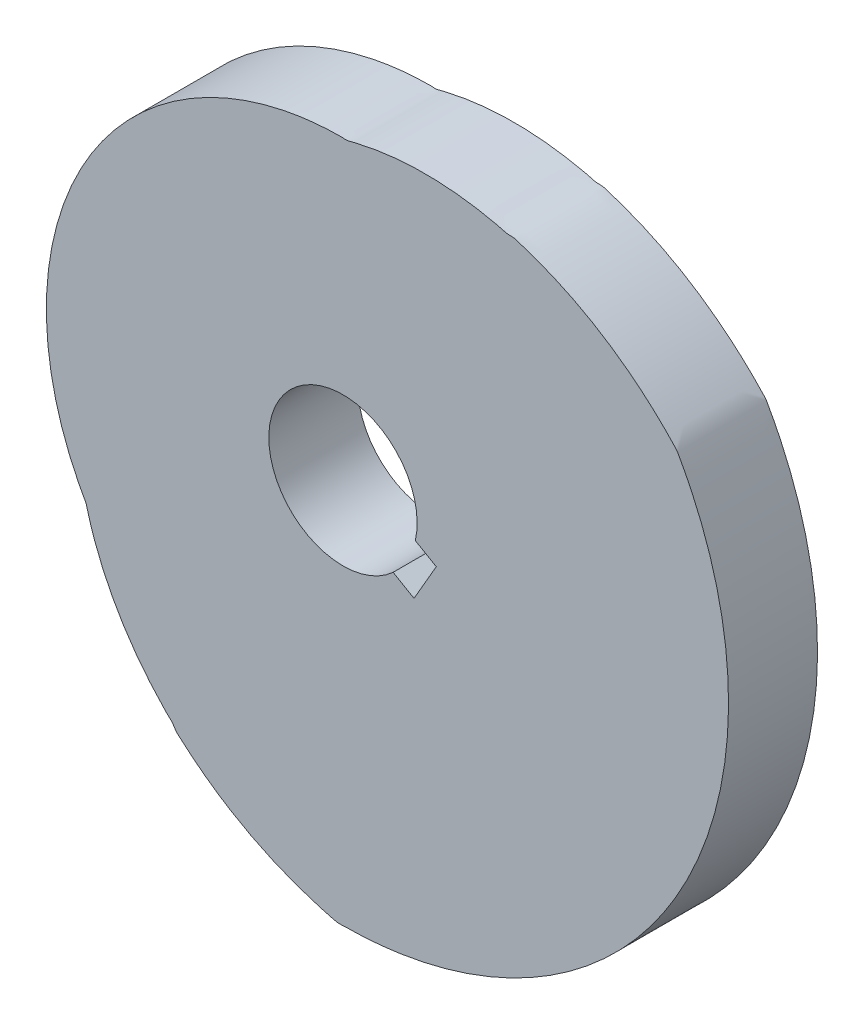
from build123d import *

# Parameters (mm, degrees)
EXTRUDE_1_DEPTH          = 12
CUT_EXTRUDE_1_DEPTH      = 12
CUT_EXTRUDE_1_DEPTH_BACK = 12


with BuildPart() as part:
    # 草图1 → 凸台-拉伸1 (new body)
    with BuildSketch(Plane.XY):
        with BuildLine():
            add(Edge.make_bspline(
                [(45.137513942, 25.818691584), (67.363308239, -13.03754157), (44.986779821, -51.807165802), (0.223448991, -51.999519907), (0.173368394, -51.99973511), (0.073206578, -52.000020819), (-0.076735083, -52.015008994), (-0.176292162, -52.026527477), (-0.226209632, -52.030572063), (-0.76984132, -52.074620074), (-1.585327729, -51.818698553), (-2.700476137, -51.534705039), (-3.585117152, -51.277157917), (-4.462156469, -51.008343252), (-5.330760731, -50.723569518), (-6.190830448, -50.424349041), (-7.04207655, -50.110546487), (-7.884266535, -49.782470849), (-8.717158972, -49.440317894), (-9.540521037, -49.084318592), (-10.354123924, -48.714699437), (-11.15774415, -48.331692882), (-11.95116328, -47.935534428), (-12.734168081, -47.526463259), (-13.506550545, -47.104721933), (-14.268107972, -46.670556345), (-15.018642937, -46.224215525), (-15.757963662, -45.76595181), (-16.485882849, -45.296019699), (-17.202222243, -44.814679573), (-17.906795909, -44.322183346), (-18.599472479, -43.818827182), (-19.279944392, -43.304755372), (-19.948584178, -42.78068738), (-20.603267989, -42.245220118), (-21.251159508, -41.704835162), (-21.864996266, -41.136775233), (-22.56359426, -40.612998942), (-22.933901912, -39.813761326), (-23.602635971, -39.271807421), (-24.161924923, -38.670643053), (-24.728607162, -38.078960902), (-25.276396551, -37.474805057), (-25.812164773, -36.86438323), (-26.333961275, -36.246404802), (-26.842192183, -35.621577129), (-27.336643537, -34.990076671), (-27.817273944, -34.352222226), (-28.284003516, -33.70829552), (-28.736770072, -33.058588827), (-29.175514163, -32.403392143), (-29.600183056, -31.742996452), (-30.010729664, -31.07769271), (-30.407112814, -30.407771968), (-30.789297161, -29.733525191), (-31.157253197, -29.055243165), (-31.510957218, -28.373216372), (-31.850391318, -27.68773488), (-32.175543356, -26.999088229), (-32.48640694, -26.307565319), (-32.782981394, -25.613454296), (-33.065271736, -24.917042442), (-33.333288643, -24.218616065), (-33.587048417, -23.518460386), (-33.82657296, -22.81685944), (-34.051889714, -22.114095933), (-34.314708945, -21.238233364), (-34.490356065, -20.593217032), (-34.594922628, -20.182781527), (-34.605205945, -20.142418354), (-34.625642332, -20.061658827), (-34.673507976, -19.943747126), (-34.714930481, -19.87147042), (-34.735585235, -19.835299805), (-51.78541399, 10.022367374), (-34.606963456, 39.806218488), (-0.22470578, 39.999368836), (-0.174341963, 39.999651767), (-0.073613259, 40.000027386), (0.076949622, 39.980885344), (0.176998451, 39.968131438), (0.227217056, 39.964299226), (0.631634375, 39.933437895), (1.247826667, 40.153308035), (2.115287997, 40.344588186), (2.832650609, 40.504262103), (3.556651151, 40.647036347), (4.286378213, 40.777919924), (5.021781645, 40.895355821), (5.762574054, 40.999563778), (6.508527263, 41.090289663), (7.259392428, 41.167412739), (8.014921694, 41.230781948), (8.77486245, 41.280260179), (9.538958992, 41.315712423), (10.306952178, 41.337009073), (11.078579631, 41.344025122), (11.853575797, 41.336640486), (12.631672044, 41.314739983), (13.412596758, 41.278213519), (14.196075388, 41.226955788), (14.981830755, 41.160867711), (15.769582319, 41.079851353), (16.559049403, 40.983829321), (17.349939546, 40.872672218), (18.141992724, 40.746471403), (18.934815746, 40.604514846), (19.728504678, 40.449133756), (20.5213078, 40.271256574), (21.318402802, 40.104660851), (22.121665669, 39.814012297), (22.990635536, 39.911526963), (23.793820403, 39.586111383), (24.590872273, 39.356137024), (25.381891295, 39.08286446), (26.172236778, 38.801327974), (26.960073334, 38.502061766), (27.745503719, 38.18760408), (28.528106932, 37.857264773), (29.307602028, 37.511231644), (30.083669328, 37.149463533), (30.855998757, 36.771988732), (31.62427697, 36.378824579), (32.388190966, 35.969999162), (33.147427273, 35.545545494), (33.901672313, 35.105503106), (34.650612462, 34.649917636), (35.393934185, 34.178840961), (36.131324153, 33.692331171), (36.862469367, 33.19045259), (37.58705728, 32.673275778), (38.304775921, 32.140877536), (39.015314014, 31.593340905), (39.718361105, 31.030755169), (40.413607681, 30.453215845), (41.1007453, 29.860824684), (41.779466706, 29.253689658), (42.449465964, 28.631924951), (43.110438547, 27.995650943), (43.932009392, 27.175323621), (44.521676935, 26.555844534), (44.893169954, 26.152711174), (44.9243311, 26.118896009), (44.986561635, 26.051181126), (45.068913792, 25.938376068), (45.114682522, 25.858606602), (45.137513942, 25.818691584)],
                knots=[0, 0, 0, 0, 0.342706251, 0.342706251, 0.342706251, 0.343279312, 0.343852373, 0.344425434, 0.344425434, 0.344425434, 0.350666416, 0.35424249, 0.35780538, 0.361355086, 0.364891613, 0.368414962, 0.371925136, 0.375422137, 0.378905969, 0.382376632, 0.385834131, 0.389278468, 0.392709645, 0.396127665, 0.399532531, 0.402924246, 0.406302812, 0.409668233, 0.41302051, 0.416359648, 0.419685648, 0.422998515, 0.426298251, 0.429584858, 0.432858341, 0.436118702, 0.439365944, 0.44260007, 0.446082767, 0.449277567, 0.452459264, 0.455627863, 0.458783366, 0.461925777, 0.465055099, 0.468171337, 0.471274493, 0.474364572, 0.477441577, 0.480505511, 0.483556379, 0.486594185, 0.489618931, 0.492630623, 0.495629265, 0.49861486, 0.501587412, 0.504546925, 0.507493405, 0.510426854, 0.513347278, 0.516254681, 0.519149067, 0.522030441, 0.524898807, 0.52775417, 0.530596534, 0.535512923, 0.535512923, 0.535512923, 0.535996412, 0.536479901, 0.53696339, 0.53696339, 0.53696339, 0.804225473, 0.804225473, 0.804225473, 0.804810089, 0.805394705, 0.805979321, 0.805979321, 0.805979321, 0.810687315, 0.81354898, 0.816423787, 0.819311741, 0.822212846, 0.825127107, 0.828054529, 0.830995116, 0.833948873, 0.836915805, 0.839895915, 0.842889208, 0.845895688, 0.84891536, 0.851948227, 0.854994294, 0.858053565, 0.861126044, 0.864211734, 0.867310639, 0.870422765, 0.873548113, 0.876686688, 0.879838494, 0.883003534, 0.886181812, 0.889373331, 0.892578096, 0.896076089, 0.899320609, 0.902578388, 0.905849428, 0.909133734, 0.912431308, 0.915742154, 0.919066274, 0.922403672, 0.925754351, 0.929118314, 0.932495564, 0.935886104, 0.939289937, 0.942707066, 0.946137493, 0.949581221, 0.953038254, 0.956508594, 0.959992244, 0.963489206, 0.966999483, 0.970523078, 0.974059994, 0.977610232, 0.981173796, 0.984750688, 0.988340911, 0.991944467, 0.998380436, 0.998380436, 0.998380436, 0.998920291, 0.999460145, 1, 1, 1, 1], degree=3, weights=[1, 0.669065134, 0.669065134, 1, 1, 1, 1, 1, 1, 1, 1, 1, 1, 1, 1, 1, 1, 1, 1, 1, 1, 1, 1, 1, 1, 1, 1, 1, 1, 1, 1, 1, 1, 1, 1, 1, 1, 1, 1, 1, 1, 1, 1, 1, 1, 1, 1, 1, 1, 1, 1, 1, 1, 1, 1, 1, 1, 1, 1, 1, 1, 1, 1, 1, 1, 1, 1, 1, 1, 1, 1, 1, 1, 1, 0.669654487, 0.669654487, 1, 1, 1, 1, 1, 1, 1, 1, 1, 1, 1, 1, 1, 1, 1, 1, 1, 1, 1, 1, 1, 1, 1, 1, 1, 1, 1, 1, 1, 1, 1, 1, 1, 1, 1, 1, 1, 1, 1, 1, 1, 1, 1, 1, 1, 1, 1, 1, 1, 1, 1, 1, 1, 1, 1, 1, 1, 1, 1, 1, 1, 1, 1, 1, 1, 1, 1, 1, 1, 1, 1]))
        make_face()
    extrude(amount=EXTRUDE_1_DEPTH)

    # 草图2 → 切除-拉伸1 (cut, two sides: drawn at the far end of the back side and taken through both)
    with BuildSketch(Plane.XY.offset(-CUT_EXTRUDE_1_DEPTH_BACK)):
        with BuildLine():
            Line((9.761355821, -2.171619796), (12.585125127, -3.801923765))
            Line((12.585125127, -3.801923765), (9.585125127, -8.998076188))
            Line((9.585125127, -8.998076188), (6.761355821, -7.367772218))
            ThreePointArc((6.761355821, -7.367772218), (-8.660254038, 5), (9.761355821, -2.171619796))
        make_face()
    extrude(amount=CUT_EXTRUDE_1_DEPTH + CUT_EXTRUDE_1_DEPTH_BACK, mode=Mode.SUBTRACT)


solid = part.part
